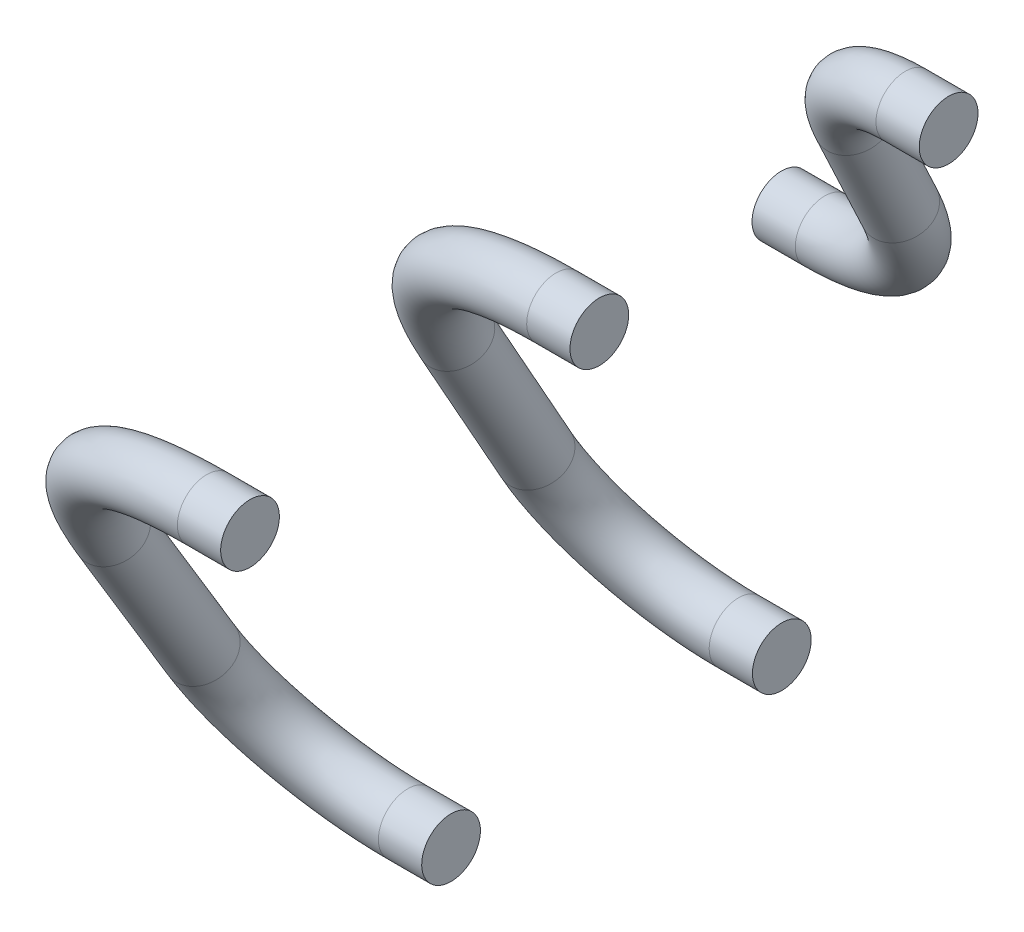
from build123d import *

# Parameters (mm, degrees)
SKETCH_7_R  = 4.75
SKETCH_9_R  = 4.75
SKETCH_11_R = 4.75


with BuildPart() as part:
    # ｽｲｰﾌﾟ1: sweep along a path in ｽｹｯﾁ6
    with BuildLine(Plane(origin=(0, 24.370215417, -49.258946057), x_dir=(-1, 0, 0), z_dir=(0, 0.44343569379034764, -0.8963061895762369))) as sweep_1_path:
        Line((125.95, 11.859546108), (132.95, 11.859546108))
        ThreePointArc((132.95, 11.859546108), (143.076541242, 7.792227153), (147.576268199, -2.149723277))
        Line((147.576268199, -2.149723277), (148.38515371, -20.911605318))
        ThreePointArc((148.38515371, -20.911605318), (154.881071995, -35.264053412), (169.5, -41.135736701))
        Line((169.5, -41.135736701), (176.5, -41.135736701))
    # ｽｹｯﾁ7 → ｽｲｰﾌﾟ1 (sweep)
    with BuildSketch(Plane(origin=(-176.5, 0, 0), x_dir=(0, 0, -1), z_dir=(1, 0, 0))):
        with Locations((67.5, -12.5)):
            Circle(SKETCH_7_R)
    sweep(path=sweep_1_path.line)


with BuildPart() as body_2:
    # ｽｲｰﾌﾟ2: sweep along a path in ｽｹｯﾁ8
    with BuildLine(Plane(origin=(0, 3.039476366, -5.420722181), x_dir=(1, 0, 0), z_dir=(0, -0.48907758783027, 0.8722402840285036))) as sweep_2_path:
        Line((-125.95, 36.641879789), (-132.95, 36.641879789))
        ThreePointArc((-132.95, 36.641879789), (-155.389220084, 27.347250501), (-164.683849372, 4.908030417))
        Line((-164.683849372, 4.908030417), (-164.683849372, -21.611235415))
        ThreePointArc((-164.683849372, -21.611235415), (-158.240198558, -37.167584602), (-142.683849372, -43.611235415))
        Line((-142.683849372, -43.611235415), (-135.683849372, -43.611235415))
    # ｽｹｯﾁ9 → ｽｲｰﾌﾟ2 (sweep)
    with BuildSketch(Plane(origin=(-125.95, 0, 0), x_dir=(0, 0, -1), z_dir=(1, 0, 0))):
        with Locations((-12.5, 35)):
            Circle(SKETCH_9_R)
    sweep(path=sweep_2_path.line)


with BuildPart() as body_3:
    # ｽｲｰﾌﾟ3: sweep along a path in ｽｹｯﾁ10
    with BuildLine(Plane(origin=(0, -21.180103028, 35.091294958), x_dir=(1, 0, 0), z_dir=(0, -0.5167422564727394, 0.85614101664122))) as sweep_3_path:
        Line((-125.95, 65.620151279), (-132.95, 65.620151279))
        ThreePointArc((-132.95, 65.620151279), (-155.389220084, 56.325521991), (-164.683849372, 33.886301907))
        Line((-164.683849372, 33.886301907), (-164.683849372, 5.857919778))
        ThreePointArc((-164.683849372, 5.857919778), (-158.240198558, -9.698429408), (-142.683849372, -16.142080222))
        Line((-142.683849372, -16.142080222), (-135.683849372, -16.142080222))
    # ｽｹｯﾁ11 → ｽｲｰﾌﾟ3 (sweep)
    with BuildSketch(Plane(origin=(-125.95, 0, 0), x_dir=(0, 0, -1), z_dir=(1, 0, 0))):
        with Locations((-69, 35)):
            Circle(SKETCH_11_R)
    sweep(path=sweep_3_path.line)


solid = Compound([part.part, body_2.part, body_3.part])
